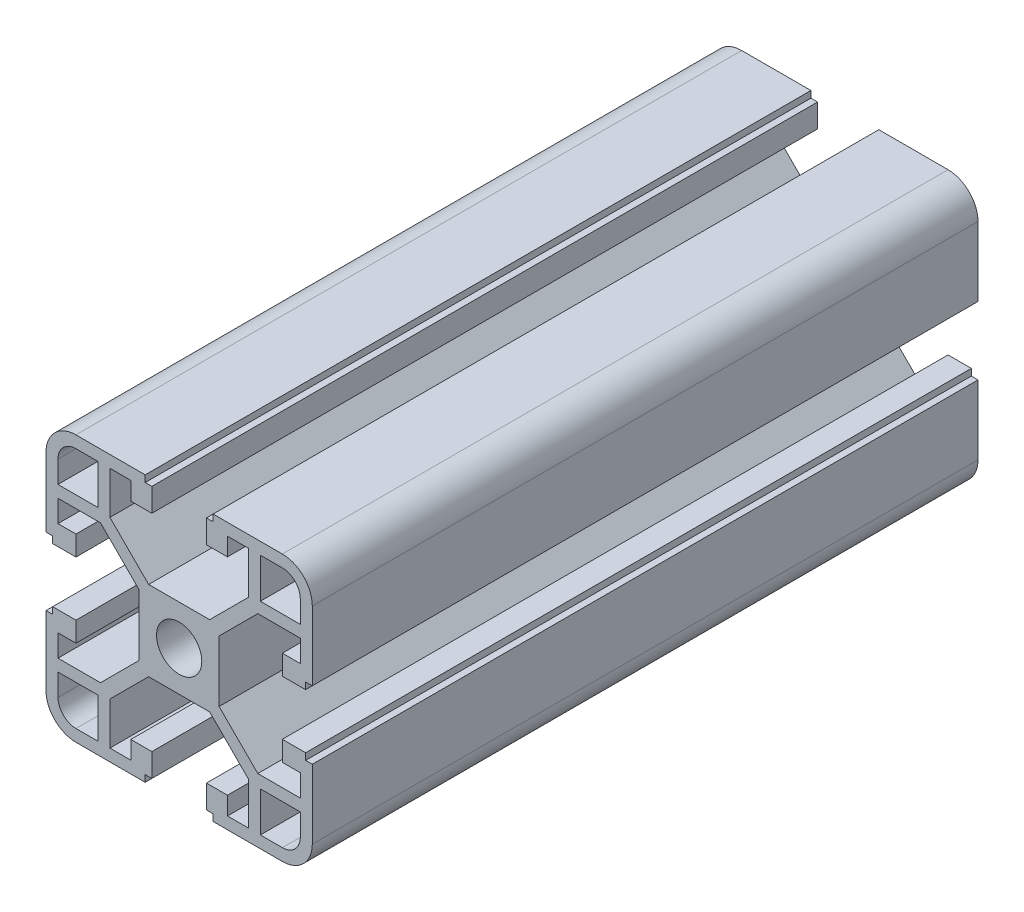
from build123d import *

# Parameters (mm, degrees)
SKETCH3_R           = 3.4
BOSS_EXTRUDE1_DEPTH = 100


with BuildPart() as part:
    # Sketch3 → Boss-Extrude1 (new body)
    with BuildSketch(Plane.XY):
        with BuildLine():
            Line((-11.814213562, 10.4), (-6, 4.585786438))
            Line((-6, 4.585786438), (-6, -4.585786438))
            Line((-6, -4.585786438), (-11.814213562, -10.4))
            Line((-11.814213562, -10.4), (-18.2, -10.4))
            Line((-18.2, -10.4), (-18.2, -7.1))
            Line((-18.2, -7.1), (-15.5, -7.1))
            Line((-15.5, -7.1), (-15.5, -4.1))
            Line((-15.5, -4.1), (-19, -4.1))
            Line((-19, -4.1), (-19, -5.1))
            Line((-19, -5.1), (-20, -5.1))
            Line((-20, -5.1), (-20, -15.5))
            ThreePointArc((-20, -15.5), (-18.681980515, -18.681980515), (-15.5, -20))
            Line((-15.5, -20), (-5.1, -20))
            Line((-5.1, -20), (-5.1, -19))
            Line((-5.1, -19), (-4.1, -19))
            Line((-4.1, -19), (-4.1, -15.5))
            Line((-4.1, -15.5), (-7.258114106, -15.5))
            Line((-7.258114106, -15.5), (-7.258114106, -18.2))
            Line((-7.258114106, -18.2), (-10.4, -18.2))
            Line((-10.4, -18.2), (-10.4, -11.814213562))
            Line((-10.4, -11.814213562), (-4.585786438, -6))
            Line((-4.585786438, -6), (4.585786438, -6))
            Line((4.585786438, -6), (10.4, -11.814213562))
            Line((10.4, -11.814213562), (10.4, -18.2))
            Line((10.4, -18.2), (7.258114106, -18.2))
            Line((7.258114106, -18.2), (7.258114106, -15.5))
            Line((7.258114106, -15.5), (4.1, -15.5))
            Line((4.1, -15.5), (4.1, -19))
            Line((4.1, -19), (5.1, -19))
            Line((5.1, -19), (5.1, -20))
            Line((5.1, -20), (15.5, -20))
            ThreePointArc((15.5, -20), (18.681980515, -18.681980515), (20, -15.5))
            Line((20, -15.5), (20, -5.1))
            Line((20, -5.1), (19, -5.1))
            Line((19, -5.1), (19, -4.1))
            Line((19, -4.1), (15.5, -4.1))
            Line((15.5, -4.1), (15.5, -7.1))
            Line((15.5, -7.1), (18.2, -7.1))
            Line((18.2, -7.1), (18.2, -10.4))
            Line((18.2, -10.4), (11.814213562, -10.4))
            Line((11.814213562, -10.4), (6, -4.585786438))
            Line((6, -4.585786438), (6, 4.585786438))
            Line((6, 4.585786438), (11.814213562, 10.4))
            Line((11.814213562, 10.4), (18.2, 10.4))
            Line((18.2, 10.4), (18.2, 7.1))
            Line((18.2, 7.1), (15.5, 7.1))
            Line((15.5, 7.1), (15.5, 4.1))
            Line((15.5, 4.1), (19, 4.1))
            Line((19, 4.1), (19, 5.1))
            Line((19, 5.1), (20, 5.1))
            Line((20, 5.1), (20, 15.5))
            ThreePointArc((20, 15.5), (18.681980515, 18.681980515), (15.5, 20))
            Line((15.5, 20), (5.1, 20))
            Line((5.1, 20), (5.1, 19))
            Line((5.1, 19), (4.1, 19))
            Line((4.1, 19), (4.1, 15.5))
            Line((4.1, 15.5), (7.258114106, 15.5))
            Line((7.258114106, 15.5), (7.258114106, 18.2))
            Line((7.258114106, 18.2), (10.4, 18.2))
            Line((10.4, 18.2), (10.4, 11.814213562))
            Line((10.4, 11.814213562), (4.585786438, 6))
            Line((4.585786438, 6), (-4.585786438, 6))
            Line((-4.585786438, 6), (-10.4, 11.814213562))
            Line((-10.4, 11.814213562), (-10.4, 18.2))
            Line((-10.4, 18.2), (-7.258114106, 18.2))
            Line((-7.258114106, 18.2), (-7.258114106, 15.5))
            Line((-7.258114106, 15.5), (-4.1, 15.5))
            Line((-4.1, 15.5), (-4.1, 19))
            Line((-4.1, 19), (-5.1, 19))
            Line((-5.1, 19), (-5.1, 20))
            Line((-5.1, 20), (-15.5, 20))
            ThreePointArc((-15.5, 20), (-18.681980515, 18.681980515), (-20, 15.5))
            Line((-20, 15.5), (-20, 5.1))
            Line((-20, 5.1), (-19, 5.1))
            Line((-19, 5.1), (-19, 4.1))
            Line((-19, 4.1), (-15.5, 4.1))
            Line((-15.5, 4.1), (-15.5, 7.1))
            Line((-15.5, 7.1), (-18.2, 7.1))
            Line((-18.2, 7.1), (-18.2, 10.4))
            Line((-18.2, 10.4), (-11.814213562, 10.4))
        make_face()
        with BuildLine():
            Line((-18.2, -15.5), (-18.2, -12.2))
            Line((-18.2, -12.2), (-12.2, -12.2))
            Line((-12.2, -12.2), (-12.2, -18.2))
            Line((-12.2, -18.2), (-15.5, -18.2))
            ThreePointArc((-15.5, -18.2), (-17.409188309, -17.409188309), (-18.2, -15.5))
        make_face(mode=Mode.SUBTRACT)
        Circle(SKETCH3_R, mode=Mode.SUBTRACT)
        with BuildLine():
            Line((-18.2, 12.2), (-18.2, 15.5))
            ThreePointArc((-18.2, 15.5), (-17.409188309, 17.409188309), (-15.5, 18.2))
            Line((-15.5, 18.2), (-12.2, 18.2))
            Line((-12.2, 18.2), (-12.2, 12.2))
            Line((-12.2, 12.2), (-18.2, 12.2))
        make_face(mode=Mode.SUBTRACT)
        with BuildLine():
            Line((18.2, 15.5), (18.2, 12.2))
            Line((18.2, 12.2), (12.2, 12.2))
            Line((12.2, 12.2), (12.2, 18.2))
            Line((12.2, 18.2), (15.5, 18.2))
            ThreePointArc((15.5, 18.2), (17.409188309, 17.409188309), (18.2, 15.5))
        make_face(mode=Mode.SUBTRACT)
        with BuildLine():
            Line((12.2, -18.2), (12.2, -12.2))
            Line((12.2, -12.2), (18.2, -12.2))
            Line((18.2, -12.2), (18.2, -15.5))
            ThreePointArc((18.2, -15.5), (17.409188309, -17.409188309), (15.5, -18.2))
            Line((15.5, -18.2), (12.2, -18.2))
        make_face(mode=Mode.SUBTRACT)
    extrude(amount=BOSS_EXTRUDE1_DEPTH)


solid = part.part
